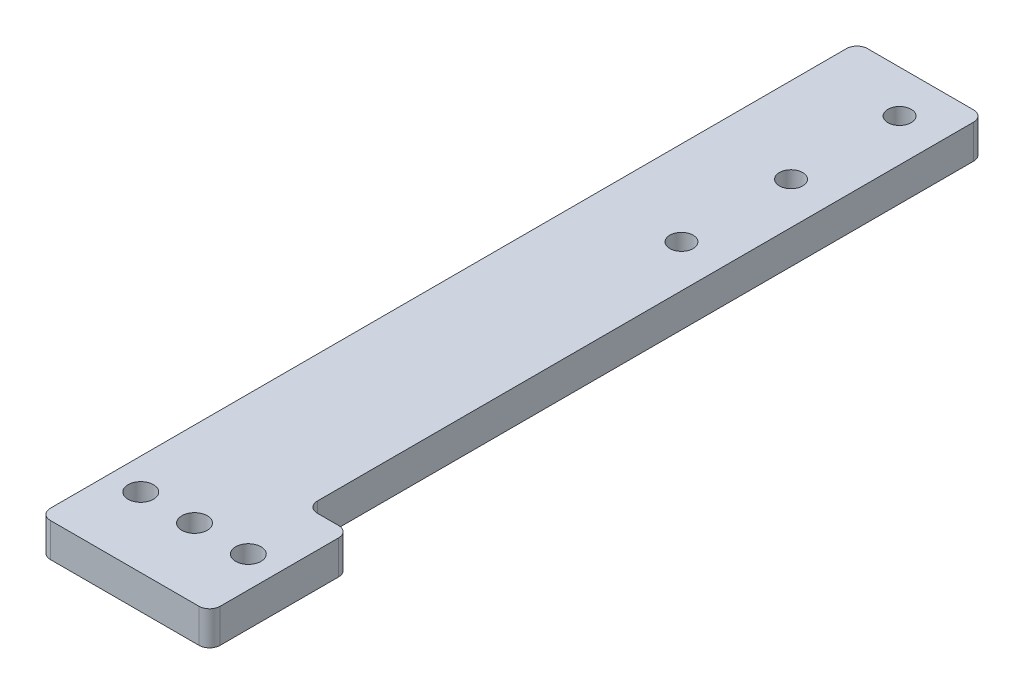
from build123d import *

# Parameters (mm, degrees)
SKETCH_1_W          = 4
SKETCH_1_H          = 32
SKETCH_1_R          = 0.55
EXTRUDE_1_DEPTH     = 1.6
SKETCH_3_W          = 8.02
SKETCH_3_H          = 6.6
EXTRUDE_2_DEPTH     = 1.6
SKETCH_4_R          = 0.6
CUT_EXTRUDE_1_DEPTH = 1.6
SKETCH_6_W          = 2.01
SKETCH_6_H          = 32
EXTRUDE_3_DEPTH     = 1.6
FILLET_1_R          = 0.5


with BuildPart() as part:
    # 草图1 → 凸台-拉伸1 (new body)
    with BuildSketch(Plane(origin=(0, 0, 0), x_dir=(1, 0, 0), z_dir=(0, 1, 0))):
        Rectangle(SKETCH_1_W, SKETCH_1_H)
        with Locations(Location((0.024094886, 8.850056366, 0), (0, 0, 270))):
            Circle(SKETCH_1_R, mode=Mode.SUBTRACT)
        with Locations(Location((0, 14, 0), (0, 0, 270))):
            Circle(SKETCH_1_R, mode=Mode.SUBTRACT)
        with Locations(Location((0, 3.700112731, 0), (0, 0, 90))):
            Circle(SKETCH_1_R, mode=Mode.SUBTRACT)
    extrude(amount=EXTRUDE_1_DEPTH)

    # 草图3 → 凸台-拉伸2 (add)
    with BuildSketch(Plane(origin=(0, 0, 0), x_dir=(1, 0, 0), z_dir=(0, 1, 0))):
        with Locations((0, -19.3)):
            Rectangle(SKETCH_3_W, SKETCH_3_H)
    extrude(amount=EXTRUDE_2_DEPTH)

    # 草图4 → 切除-拉伸1 (cut)
    with BuildSketch(Plane(origin=(0, 1.6, 0), x_dir=(1, 0, 0), z_dir=(0, 1, 0))):
        with Locations(Location((0, -19.3, 0), (0, 0, 270))):
            Circle(SKETCH_4_R)
        with Locations(Location((-2.54, -19.3, 0), (0, 0, 270))):
            Circle(SKETCH_4_R)
        with Locations(Location((2.54, -19.3, 0), (0, 0, 90))):
            Circle(SKETCH_4_R)
    extrude(amount=-CUT_EXTRUDE_1_DEPTH, mode=Mode.SUBTRACT)

    # 草图6 → 凸台-拉伸3 (add)
    with BuildSketch(Plane(origin=(0, 0, 0), x_dir=(1, 0, 0), z_dir=(0, 1, 0))):
        with Locations((-3.005, 0)):
            Rectangle(SKETCH_6_W, SKETCH_6_H)
    extrude(amount=EXTRUDE_3_DEPTH)

    # 圆角1
    fillet_1_edges = [part.edges().sort_by_distance(p)[0] for p in [
        (4.01, 0.8, 22.6),
        (4.01, 0.8, 16),
        (-4.01, 0.8, 22.6),
        (-4.01, 0.8, -16),
        (2, 0.8, 16),
        (2, 0.8, -16),
    ]]
    fillet(fillet_1_edges, radius=FILLET_1_R)


solid = part.part
